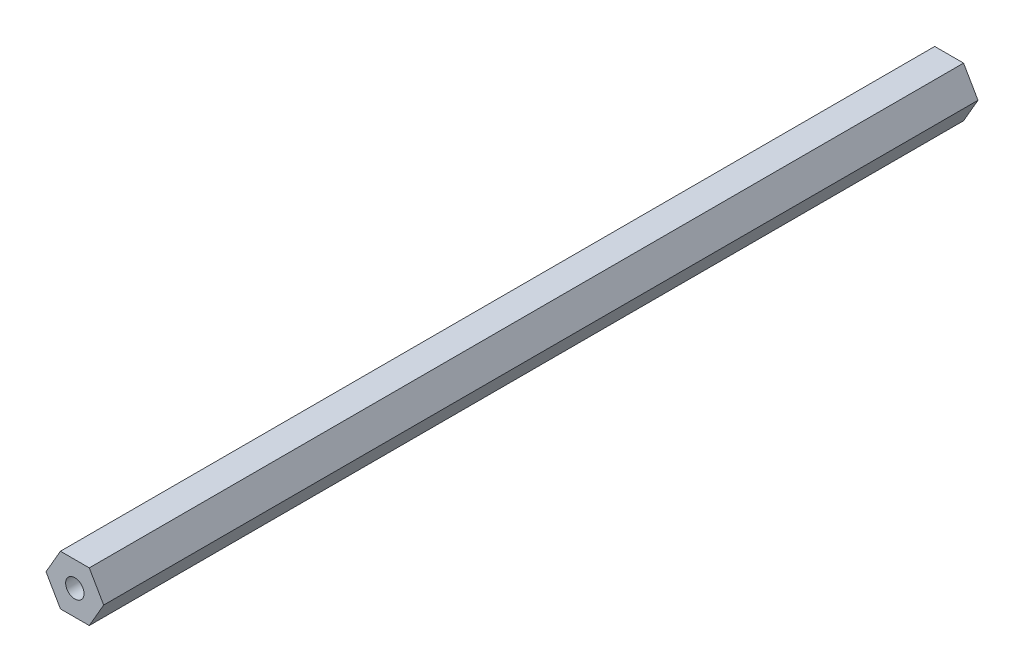
from build123d import *

# Parameters (mm, degrees)
BOSS_EXTRUDE1_DEPTH = 140
SKETCH2_R           = 1.475
CUT_EXTRUDE1_DEPTH  = 220


with BuildPart() as part:
    # Sketch1 → Boss-Extrude1 (new body)
    with BuildSketch(Plane.XY):
        Polygon((2.309401077, 4), (-2.309401077, 4), (-4.618802154, 0), (-2.309401077, -4), (2.309401077, -4), (4.618802154, 0), align=None)
    extrude(amount=BOSS_EXTRUDE1_DEPTH)

    # Sketch2 → Cut-Extrude1 (cut)
    with BuildSketch(Plane(origin=(0, 0, 0), x_dir=(-1, 0, 0), z_dir=(0, 0, -1))):
        Circle(SKETCH2_R)
    extrude(amount=-CUT_EXTRUDE1_DEPTH, mode=Mode.SUBTRACT)


solid = part.part
